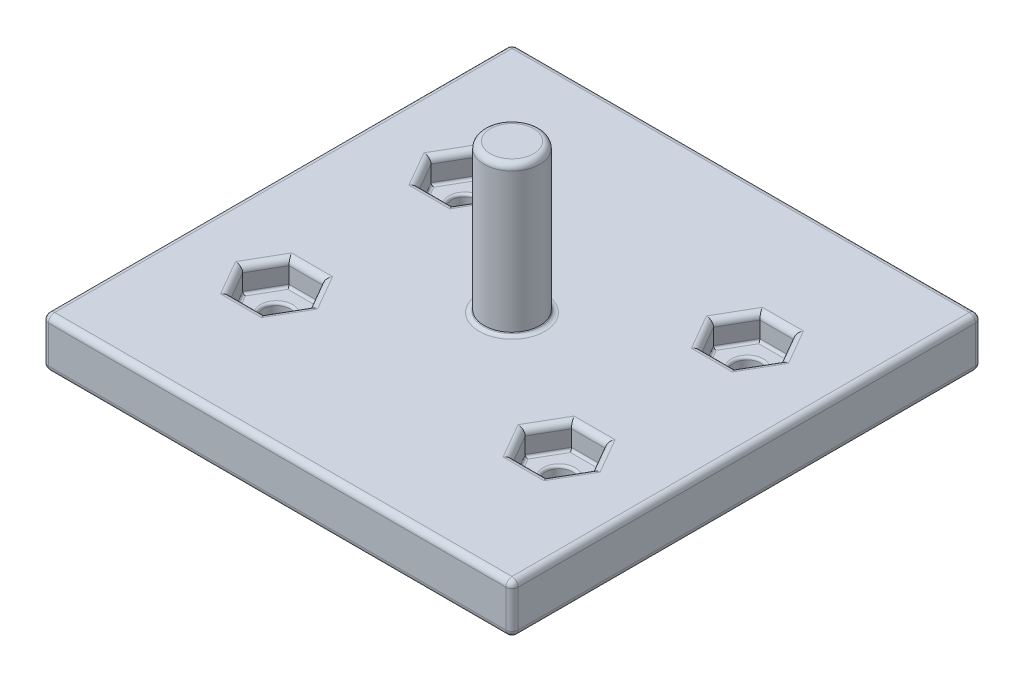
from build123d import *

# Parameters (mm, degrees)
SKETCH2_W                = 38
SKETCH2_H                = 38
SKETCH2_R                = 2.25
BOSS_EXTRUDE1_DEPTH      = 2
BOSS_EXTRUDE2_START      = -2
SKETCH2_3_W              = 38
SKETCH2_3_H              = 38
SKETCH2_3_R              = 1.1
SKETCH2_3_R_2            = 2.25
BOSS_EXTRUDE2_DEPTH      = 2
BOSS_EXTRUDE3_DEPTH      = 14
BOSS_EXTRUDE3_DEPTH_BACK = 2
SKETCH2_4_R              = 2.25
CHAMFER1_SIZE            = 0.2
FILLET1_R                = 0.5
FILLET2_R                = 0.5
FILLET3_R                = 0.2


with BuildPart() as part:
    # Sketch2 → Boss-Extrude1 (new body)
    with BuildSketch(Plane(origin=(0, 0, 0), x_dir=(1, 0, 0), z_dir=(0, 1, 0))):
        Rectangle(SKETCH2_W, SKETCH2_H)
        Polygon((-10.058793111, -5.245), (-8.687586221, -7.62), (-10.058793111, -9.995), (-12.801206889, -9.995), (-14.172413779, -7.62), (-12.801206889, -5.245), align=None, mode=Mode.SUBTRACT)
        Circle(SKETCH2_R, mode=Mode.SUBTRACT)
        Polygon((12.801206889, -5.245), (14.172413779, -7.62), (12.801206889, -9.995), (10.058793111, -9.995), (8.687586221, -7.62), (10.058793111, -5.245), align=None, mode=Mode.SUBTRACT)
        Polygon((-10.058793111, 9.995), (-8.687586221, 7.62), (-10.058793111, 5.245), (-12.801206889, 5.245), (-14.172413779, 7.62), (-12.801206889, 9.995), align=None, mode=Mode.SUBTRACT)
        Polygon((12.801206889, 9.995), (14.172413779, 7.62), (12.801206889, 5.245), (10.058793111, 5.245), (8.687586221, 7.62), (10.058793111, 9.995), align=None, mode=Mode.SUBTRACT)
    extrude(amount=BOSS_EXTRUDE1_DEPTH)

    # Sketch2<3> → Boss-Extrude2 (add)
    with BuildSketch(Plane(origin=(0, 0, 0), x_dir=(1, 0, 0), z_dir=(0, 1, 0)).offset(BOSS_EXTRUDE2_START)):
        Rectangle(SKETCH2_3_W, SKETCH2_3_H)
        with Locations((-11.43, 7.62)):
            Circle(SKETCH2_3_R, mode=Mode.SUBTRACT)
        Circle(SKETCH2_3_R_2, mode=Mode.SUBTRACT)
        with Locations((-11.43, -7.62)):
            Circle(SKETCH2_3_R, mode=Mode.SUBTRACT)
        with Locations((11.43, -7.62)):
            Circle(SKETCH2_3_R, mode=Mode.SUBTRACT)
        with Locations((11.43, 7.62)):
            Circle(SKETCH2_3_R, mode=Mode.SUBTRACT)
    extrude(amount=BOSS_EXTRUDE2_DEPTH)

    # Sketch2<4> → Boss-Extrude3 (add, two sides: drawn at the far end of the back side and taken through both)
    with BuildSketch(Plane(origin=(0, 0, 0), x_dir=(1, 0, 0), z_dir=(0, 1, 0)).offset(-BOSS_EXTRUDE3_DEPTH_BACK)):
        Circle(SKETCH2_4_R)
    extrude(amount=BOSS_EXTRUDE3_DEPTH + BOSS_EXTRUDE3_DEPTH_BACK)

    # Chamfer1
    chamfer1_edges = [part.edges().sort_by_distance(p)[0] for p in [
        (-2.25, 2, 0),
    ]]
    chamfer(chamfer1_edges, length=CHAMFER1_SIZE)

    # Fillet1
    fillet1_edges = [part.edges().sort_by_distance(p)[0] for p in [
        (-2.25, 14, 0),
    ]]
    fillet(fillet1_edges, radius=FILLET1_R)

    # Fillet2
    fillet2_edges = [part.edges().sort_by_distance(p)[0] for p in [
        (13.486810334, 2, -8.8075),
        (11.43, 2, -9.995),
        (9.373189666, 2, -8.8075),
        (9.373189666, 2, -6.4325),
        (11.43, 2, -5.245),
        (13.486810334, 2, -6.4325),
        (-9.373189666, 2, -8.8075),
        (-11.43, 2, -9.995),
        (-13.486810334, 2, -8.8075),
        (-13.486810334, 2, -6.4325),
        (-11.43, 2, -5.245),
        (-9.373189666, 2, -6.4325),
        (-9.373189666, 2, 6.4325),
        (-11.43, 2, 5.245),
        (-13.486810334, 2, 6.4325),
        (-13.486810334, 2, 8.8075),
        (-11.43, 2, 9.995),
        (-9.373189666, 2, 8.8075),
        (13.486810334, 2, 6.4325),
        (11.43, 2, 5.245),
        (9.373189666, 2, 6.4325),
        (9.373189666, 2, 8.8075),
        (11.43, 2, 9.995),
        (13.486810334, 2, 8.8075),
        (-2.45, 2, 0),
        (10.33, -2, 7.62),
        (-12.53, -2, 7.62),
        (-12.53, -2, -7.62),
        (10.33, -2, -7.62),
        (-19, 2, 0),
        (-19, -2, 0),
        (0, 2, 19),
        (0, -2, 19),
        (-19, 0, 19),
        (19, 2, 0),
        (19, -2, 0),
        (19, 0, 19),
        (0, 2, -19),
        (-19, 0, -19),
        (0, -2, -19),
        (19, 0, -19),
    ]]
    fillet(fillet2_edges, radius=FILLET2_R)

    # Fillet3
    fillet3_edges = [part.edges().sort_by_distance(p)[0] for p in [
        (10.33, 0, 7.62),
        (9.373189666, 0, 8.8075),
        (9.373189666, 0, 6.4325),
        (11.43, 0, 5.245),
        (13.486810334, 0, 6.4325),
        (13.486810334, 0, 8.8075),
        (11.43, 0, 9.995),
        (10.33, 0, -7.62),
        (9.373189666, 0, -6.4325),
        (9.373189666, 0, -8.8075),
        (11.43, 0, -9.995),
        (13.486810334, 0, -8.8075),
        (13.486810334, 0, -6.4325),
        (11.43, 0, -5.245),
        (-12.53, 0, 7.62),
        (-13.486810334, 0, 8.8075),
        (-13.486810334, 0, 6.4325),
        (-11.43, 0, 5.245),
        (-9.373189666, 0, 6.4325),
        (-9.373189666, 0, 8.8075),
        (-11.43, 0, 9.995),
        (-12.53, 0, -7.62),
        (-13.486810334, 0, -6.4325),
        (-13.486810334, 0, -8.8075),
        (-11.43, 0, -9.995),
        (-9.373189666, 0, -8.8075),
        (-9.373189666, 0, -6.4325),
        (-11.43, 0, -5.245),
    ]]
    fillet(fillet3_edges, radius=FILLET3_R)


solid = part.part
